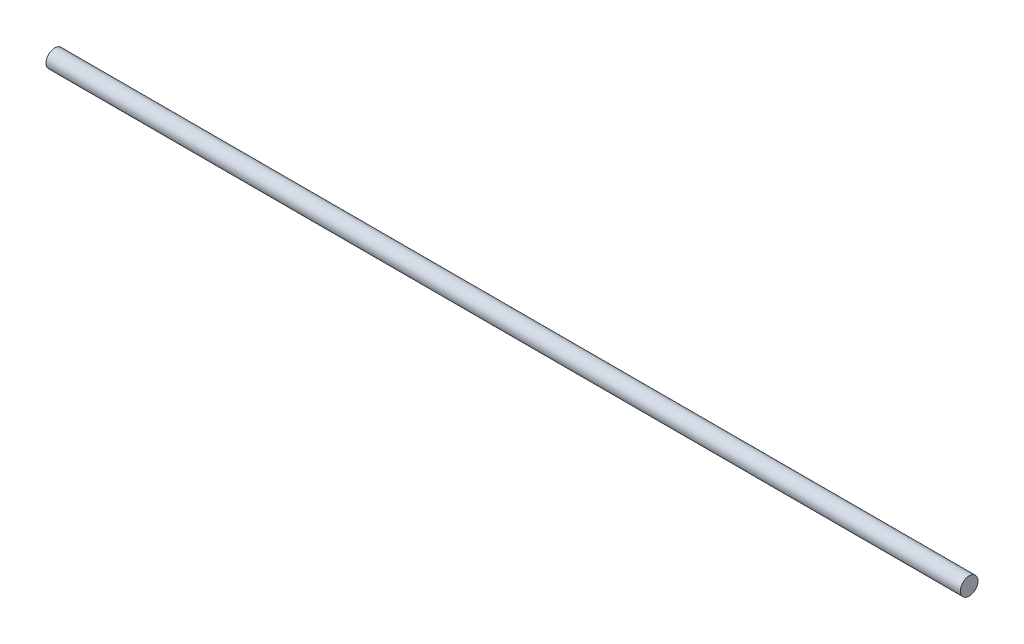
from build123d import *

# Parameters (mm, degrees)
SKETCH1_R           = 3.175
BOSS_EXTRUDE1_DEPTH = 330.2


with BuildPart() as part:
    # Sketch1 → Boss-Extrude1 (new body)
    with BuildSketch(Plane(origin=(0, 0, 0), x_dir=(0, 0, -1), z_dir=(1, 0, 0))):
        Circle(SKETCH1_R)
    extrude(amount=BOSS_EXTRUDE1_DEPTH)


solid = part.part
